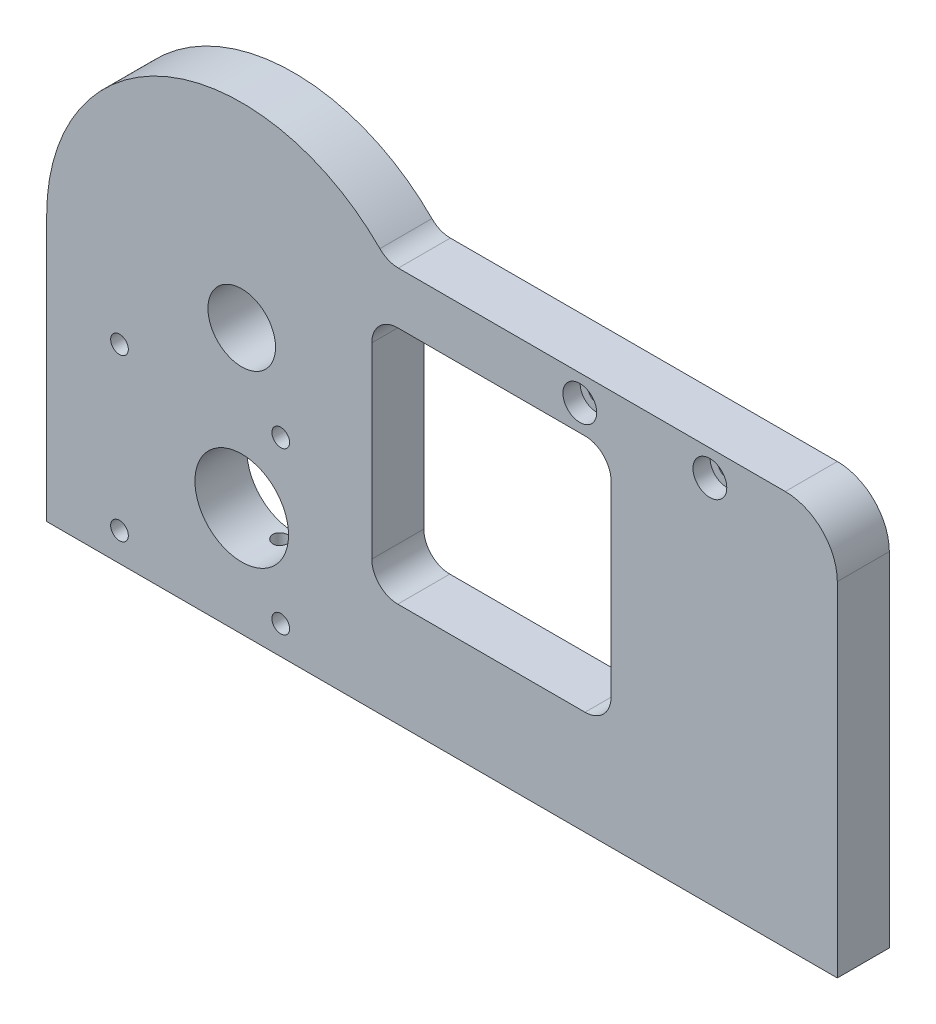
from build123d import *

# Parameters (mm, degrees)
BOSS_EXTRUDE1_DEPTH                      = 10
FILLET1_R                                = 5
FILLET2_R                                = 10
SKETCH2_R                                = 9
CUT_EXTRUDE1_DEPTH                       = 177.171081622
SKETCH3_R                                = 6.5
CUT_EXTRUDE2_DEPTH                       = 177.171081622
SKETCH4_W                                = 46
SKETCH4_H                                = 46
CUT_EXTRUDE3_DEPTH                       = 177.171081622
CUT_EXTRUDE4_REACH                       = 178.171
CUT_EXTRUDE4_END_RADIUS                  = 9
SKETCH5_R                                = 1.5
FILLET3_R                                = 5
M3X0_5_TAPPED_HOLE1_D                    = 2.6
M3X0_5_TAPPED_HOLE1_DEPTH                = 9
M3X0_5_TAPPED_HOLE1_TIP                  = 0.781118805
CBORE_FOR_M3_PAN_HEAD_SCREW1_D           = 3.4
CBORE_FOR_M3_PAN_HEAD_SCREW1_CBORE_D     = 6.5
CBORE_FOR_M3_PAN_HEAD_SCREW1_CBORE_DEPTH = 3.3
CBORE_FOR_M3_PAN_HEAD_SCREW2_D           = 3.4
CBORE_FOR_M3_PAN_HEAD_SCREW2_CBORE_D     = 6.5
CBORE_FOR_M3_PAN_HEAD_SCREW2_CBORE_DEPTH = 3.3


with BuildPart() as part:
    # Sketch1 → Boss-Extrude1 (new body)
    with BuildSketch(Plane.XY):
        with BuildLine():
            Line((0, 0), (152, 0))
            Line((152, 0), (152, 76))
            Line((152, 76), (65.450849719, 76))
            ThreePointArc((65.450849719, 76), (24.119171634, 86.031463461), (0, 51))
            Line((0, 51), (0, 0))
        make_face()
    extrude(amount=BOSS_EXTRUDE1_DEPTH)

    # Fillet1
    fillet1_edges = [part.edges().sort_by_distance(p)[0] for p in [
        (65.450849719, 76, 5),
    ]]
    fillet(fillet1_edges, radius=FILLET1_R)

    # Fillet2
    fillet2_edges = [part.edges().sort_by_distance(p)[0] for p in [
        (152, 76, 5),
    ]]
    fillet(fillet2_edges, radius=FILLET2_R)

    # Sketch2 → Cut-Extrude1 (cut, through all)
    with BuildSketch(Plane.XY.offset(10)):
        with Locations((37.5, 21)):
            Circle(SKETCH2_R)
    extrude(amount=-CUT_EXTRUDE1_DEPTH, mode=Mode.SUBTRACT)

    # Sketch3 → Cut-Extrude2 (cut, through all)
    with BuildSketch(Plane.XY.offset(10)):
        with Locations((37.5, 51)):
            Circle(SKETCH3_R)
    extrude(amount=-CUT_EXTRUDE2_DEPTH, mode=Mode.SUBTRACT)

    # Sketch4 → Cut-Extrude3 (cut, through all)
    with BuildSketch(Plane.XY.offset(10)):
        with Locations((85.5, 43)):
            Rectangle(SKETCH4_W, SKETCH4_H)
    extrude(amount=-CUT_EXTRUDE3_DEPTH, mode=Mode.SUBTRACT)

    # Cut-Extrude4: up to this cylinder (the profile starts outside it)
    cut_extrude4_end = Plane(origin=(37.5, 21, 2.5), z_dir=(0, 0, 1)) * Cylinder(CUT_EXTRUDE4_END_RADIUS, 375.342, mode=Mode.PRIVATE)
    # Sketch5 → Cut-Extrude4 (cut, up to the surface)
    with BuildSketch(Plane.XZ, mode=Mode.PRIVATE) as cut_extrude4_sk1:
        with Locations(Location((37.5, 2.5, 0), (0, 0, 270))):
            Circle(SKETCH5_R)
    cut_extrude4_tool1 = extrude(cut_extrude4_sk1.sketch, amount=-CUT_EXTRUDE4_REACH, mode=Mode.PRIVATE) - cut_extrude4_end
    add(cut_extrude4_tool1.solids().sort_by_distance((37.5, 0, 2.5))[0], mode=Mode.SUBTRACT)

    # Fillet3
    fillet3_edges = [part.edges().sort_by_distance(p)[0] for p in [
        (62.5, 20, 5),
        (62.5, 66, 5),
        (108.5, 66, 5),
        (108.5, 20, 5),
    ]]
    fillet(fillet3_edges, radius=FILLET3_R)

    # M3x0.5 Tapped Hole1
    with Locations(Plane(origin=(0, 0, 0), x_dir=(-1, 0, 0), z_dir=(0, -1, 0))):
        with Locations((-16, -5), (-56, -5), (-96, -5), (-136, -5)):
            Hole(M3X0_5_TAPPED_HOLE1_D / 2, depth=M3X0_5_TAPPED_HOLE1_DEPTH)
            with Locations((0, 0, -(M3X0_5_TAPPED_HOLE1_DEPTH + M3X0_5_TAPPED_HOLE1_TIP / 2))):  # 118° drill point
                Cone(0, M3X0_5_TAPPED_HOLE1_D / 2, M3X0_5_TAPPED_HOLE1_TIP, mode=Mode.SUBTRACT)

    # CBORE for M3 Pan Head Screw1 (through all)
    with Locations(Plane(origin=(0, 0, 0), x_dir=(1, 0, 0), z_dir=(0, 0, -1))):
        with Locations((14, -36.5), (45, -36.5), (45, -5.5), (14, -5.5)):
            CounterBoreHole(CBORE_FOR_M3_PAN_HEAD_SCREW1_D / 2, CBORE_FOR_M3_PAN_HEAD_SCREW1_CBORE_D / 2, CBORE_FOR_M3_PAN_HEAD_SCREW1_CBORE_DEPTH)

    # CBORE for M3 Pan Head Screw2 (through all)
    with Locations(Plane(origin=(0, 0, 10), x_dir=(-1, 0, 0), z_dir=(0, 0, 1))):
        with Locations((-127.5, -71), (-102.5, -71)):
            CounterBoreHole(CBORE_FOR_M3_PAN_HEAD_SCREW2_D / 2, CBORE_FOR_M3_PAN_HEAD_SCREW2_CBORE_D / 2, CBORE_FOR_M3_PAN_HEAD_SCREW2_CBORE_DEPTH)


solid = part.part
